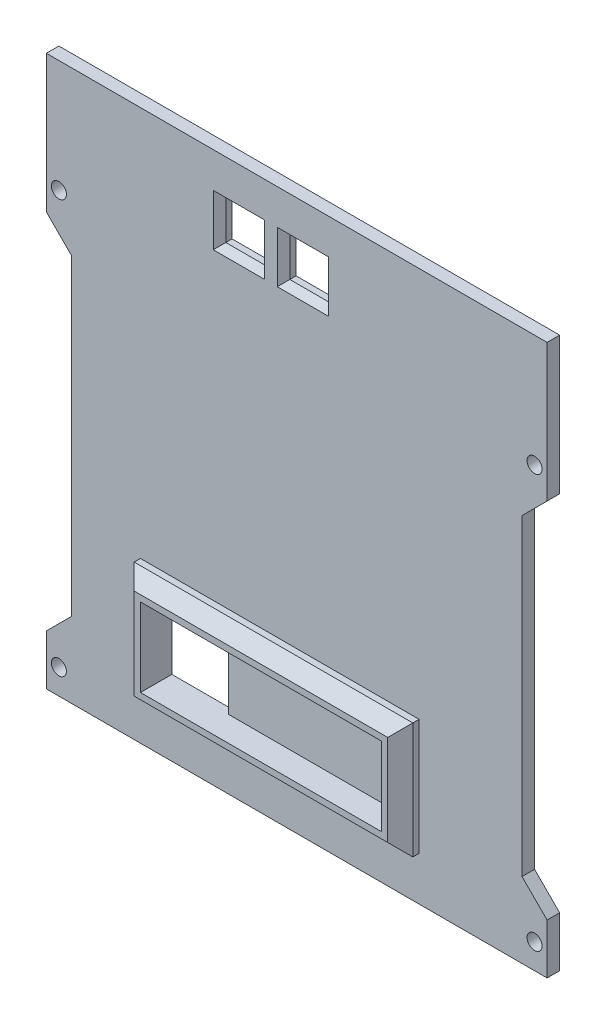
from build123d import *

# Parameters (mm, degrees)
SKETCH_1_W          = 6.2
SKETCH_1_H          = 6.2
SKETCH_1_R          = 1.2
EXTRUDE_1_DEPTH     = 2
CUT_EXTRUDE_1_DEPTH = 1
SKETCH_3_W          = 10
SKETCH_3_H          = 12.5
CUT_EXTRUDE_2_DEPTH = 1
CHAMFER_1_SIZE      = 1
SKETCH_4_W          = 44.4
SKETCH_4_H          = 18.5
SKETCH_4_W_2        = 38.4
SKETCH_4_H_2        = 12.5
EXTRUDE_2_DEPTH     = 3
CHAMFER_2_SIZE      = 2


with BuildPart() as part:
    # 草图1 → 凸台-拉伸1 (new body)
    with BuildSketch(Plane.XY):
        Polygon((-68.63, 16.2), (-64.63, 12.2), (-64.63, -37.62), (-68.63, -41.62), (-68.63, -49.62), (11.17, -49.62), (11.17, -41.62), (7.17, -37.62), (7.17, 12.2), (11.17, 16.2), (11.17, 38.1), (-68.63, 38.1), align=None)
        with Locations((-37.93, 28.38)):
            Rectangle(SKETCH_1_W, SKETCH_1_H, mode=Mode.SUBTRACT)
        with Locations((-27.73, 28.38)):
            Rectangle(SKETCH_1_W, SKETCH_1_H, mode=Mode.SUBTRACT)
        with Locations((-66.63, -45.62)):
            Circle(SKETCH_1_R, mode=Mode.SUBTRACT)
        with Locations((9.17, -45.62)):
            Circle(SKETCH_1_R, mode=Mode.SUBTRACT)
        with Locations((-66.63, 20.2)):
            Circle(SKETCH_1_R, mode=Mode.SUBTRACT)
        with Locations((9.17, 20.2)):
            Circle(SKETCH_1_R, mode=Mode.SUBTRACT)
    extrude(amount=EXTRUDE_1_DEPTH)

    # 草图2 → 切除-拉伸1 (cut)
    with BuildSketch(Plane.XY.offset(2)):
        Polygon((-12.23, -27.12), (-39.83, -27.12), (-39.83, -35.02), (-39.83, -39.62), (-12.23, -39.62), align=None)
        Polygon((-39.83, -27.12), (-50.63, -27.12), (-50.63, -39.62), (-39.83, -39.62), (-39.83, -35.02), align=None)
    extrude(amount=-CUT_EXTRUDE_1_DEPTH, mode=Mode.SUBTRACT)

    # 草图3 → 切除-拉伸2 (cut)
    with BuildSketch(Plane.XY.offset(1)):
        with Locations((-45.63, -33.37)):
            Rectangle(SKETCH_3_W, SKETCH_3_H)
    extrude(amount=-CUT_EXTRUDE_2_DEPTH, mode=Mode.SUBTRACT)

    # 倒角1
    chamfer_1_edges = [part.edges().sort_by_distance(p)[0] for p in [
        (-37.93, 25.28, 2),
        (-41.03, 28.38, 2),
        (-37.93, 31.48, 2),
        (-27.73, 31.48, 2),
        (-24.63, 28.38, 2),
        (-27.73, 25.28, 2),
        (-30.83, 28.38, 2),
        (-34.83, 28.38, 2),
    ]]
    chamfer(chamfer_1_edges, length=CHAMFER_1_SIZE)

    # 草图4 → 凸台-拉伸2 (add)
    with BuildSketch(Plane.XY.offset(2)):
        with Locations((-31.43, -33.37)):
            Rectangle(SKETCH_4_W, SKETCH_4_H)
        with Locations((-31.43, -33.37)):
            Rectangle(SKETCH_4_W_2, SKETCH_4_H_2, mode=Mode.SUBTRACT)
    extrude(amount=EXTRUDE_2_DEPTH)

    # 倒角2
    chamfer_2_edges = [part.edges().sort_by_distance(p)[0] for p in [
        (-31.43, -24.12, 5),
        (-9.23, -33.37, 5),
        (-53.63, -33.37, 5),
        (-31.43, -42.62, 5),
    ]]
    chamfer(chamfer_2_edges, length=CHAMFER_2_SIZE)


solid = part.part
